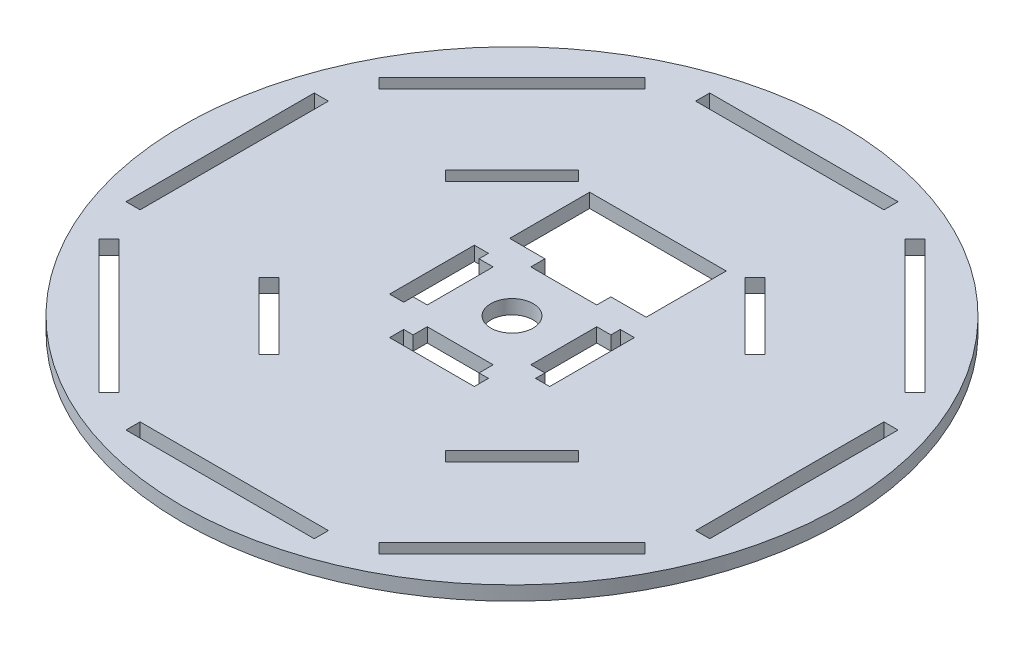
from build123d import *

# Parameters (mm, degrees)
CROQUIS1_R              = 70
CROQUIS1_R_2            = 4.5
SALIENTE_EXTRUIR1_DEPTH = 3


with BuildPart() as part:
    # Croquis1 → Saliente-Extruir1 (new body)
    with BuildSketch(Plane(origin=(0, 0, 0), x_dir=(1, 0, 0), z_dir=(0, 1, 0))):
        with Locations(Location((0, 0, 0), (0, 0, 270))):
            Circle(CROQUIS1_R)
        with Locations(Location((0, 0, 0), (0, 0, 270))):
            Circle(CROQUIS1_R_2, mode=Mode.SUBTRACT)
        Polygon((0, 11), (7, 11), (7, 14), (14.5, 14), (14.5, 31), (-14.5, 31), (-14.5, 14), (-7, 14), (-7, 11), align=None, mode=Mode.SUBTRACT)
        Polygon((24.748737342, 24.748737342), (31.819805153, 17.67766953), (33.941125497, 19.798989873), (19.798989873, 33.941125497), (17.67766953, 31.819805153), align=None, mode=Mode.SUBTRACT)
        Polygon((11, 0), (11, 7), (14, 7), (14, 9), (17, 9), (17, 0), (17, -9), (14, -9), (14, -7), (11, -7), align=None, mode=Mode.SUBTRACT)
        Polygon((-24.748737342, 24.748737342), (-17.67766953, 31.819805153), (-19.798989873, 33.941125497), (-33.941125497, 19.798989873), (-31.819805153, 17.67766953), align=None, mode=Mode.SUBTRACT)
        Polygon((-14, -7), (-11, -7), (-11, 0), (-11, 7), (-14, 7), (-14, 9), (-17, 9), (-17, -9), (-14, -9), align=None, mode=Mode.SUBTRACT)
        Polygon((-7, -14), (-9, -14), (-9, -17), (0, -17), (9, -17), (9, -14), (7, -14), (7, -11), (0, -11), (-7, -11), align=None, mode=Mode.SUBTRACT)
        Polygon((24.748737342, -24.748737342), (17.67766953, -31.819805153), (19.798989873, -33.941125497), (33.941125497, -19.798989873), (31.819805153, -17.67766953), align=None, mode=Mode.SUBTRACT)
        Polygon((-24.748737342, -24.748737342), (-31.819805153, -17.67766953), (-33.941125497, -19.798989873), (-19.798989873, -33.941125497), (-17.67766953, -31.819805153), align=None, mode=Mode.SUBTRACT)
        Polygon((0, 62), (20, 62), (20, 59), (-20, 59), (-20, 62), align=None, mode=Mode.SUBTRACT)
        Polygon((55.861435714, 27.577164466), (27.577164466, 55.861435714), (29.69848481, 57.982756057), (43.840620434, 43.840620434), (57.982756057, 29.69848481), align=None, mode=Mode.SUBTRACT)
        Polygon((59, -20), (59, 20), (62, 20), (62, 0), (62, -20), align=None, mode=Mode.SUBTRACT)
        Polygon((27.577164466, -55.861435714), (55.861435714, -27.577164466), (57.982756057, -29.69848481), (43.840620434, -43.840620434), (29.69848481, -57.982756057), align=None, mode=Mode.SUBTRACT)
        Polygon((-20, -59), (20, -59), (20, -62), (0, -62), (-20, -62), align=None, mode=Mode.SUBTRACT)
        Polygon((-55.861435714, -27.577164466), (-27.577164466, -55.861435714), (-29.69848481, -57.982756057), (-43.840620434, -43.840620434), (-57.982756057, -29.69848481), align=None, mode=Mode.SUBTRACT)
        Polygon((-59, 20), (-59, -20), (-62, -20), (-62, 0), (-62, 20), align=None, mode=Mode.SUBTRACT)
        Polygon((-27.577164466, 55.861435714), (-55.861435714, 27.577164466), (-57.982756057, 29.69848481), (-43.840620434, 43.840620434), (-29.69848481, 57.982756057), align=None, mode=Mode.SUBTRACT)
    extrude(amount=SALIENTE_EXTRUIR1_DEPTH)


solid = part.part
